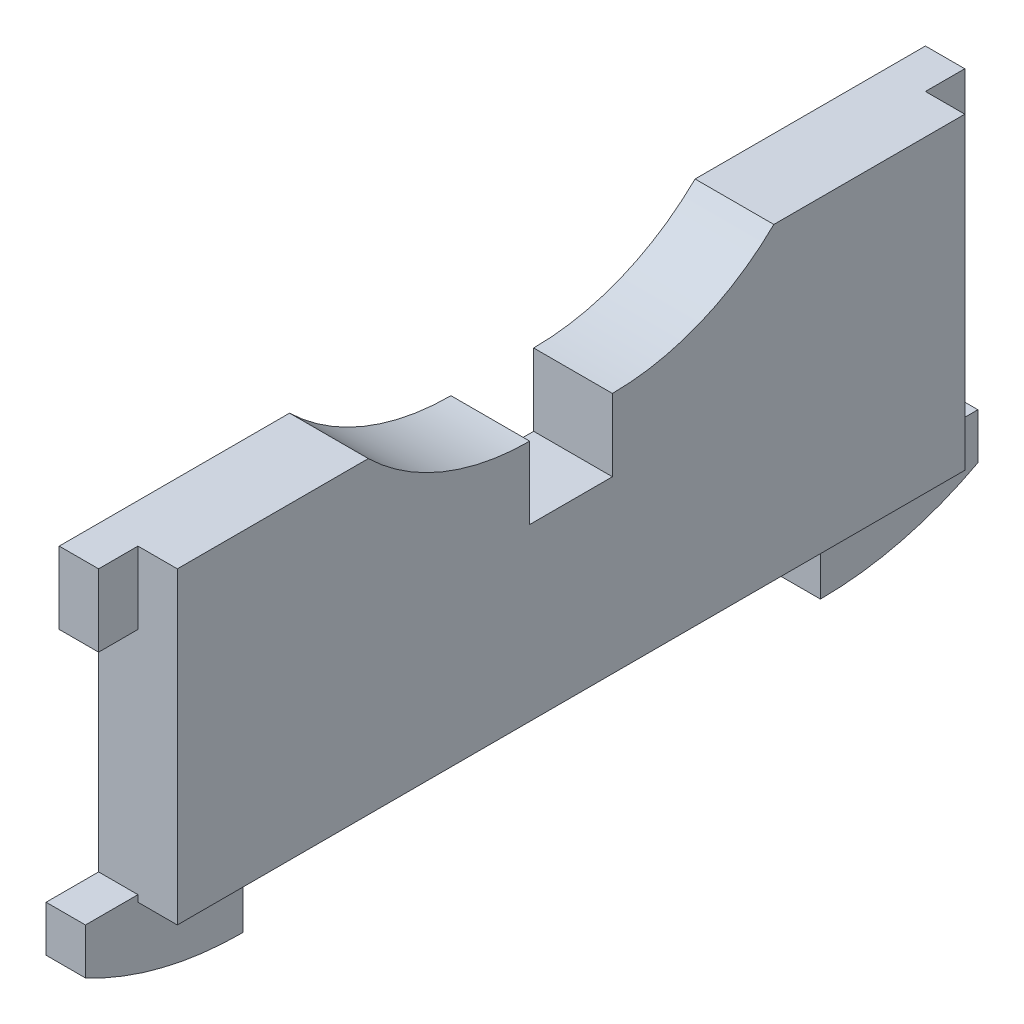
from build123d import *

# Parameters (mm, degrees)
BOSS_EXTRUDE1_DEPTH = 3
BOSS_EXTRUDE2_START = 3
BOSS_EXTRUDE2_DEPTH = 3


with BuildPart() as part:
    # Sketch1 → Boss-Extrude1 (new body)
    with BuildSketch(Plane(origin=(0, 0, 0), x_dir=(0, 0, -1), z_dir=(1, 0, 0))):
        with BuildLine():
            Line((-3.15, 0), (3.15, 0))
            Line((3.15, 0), (3.15, 5.5))
            ThreePointArc((3.15, 5.5), (9.788712225, 6.797767928), (15.45, 10.5))
            Line((15.45, 10.5), (30, 10.5))
            Line((30, 10.5), (30, -13))
            Line((30, -13), (-30, -13))
            Line((-30, -13), (-30, 10.5))
            Line((-30, 10.5), (-15.45, 10.5))
            ThreePointArc((-15.45, 10.5), (-9.788712225, 6.797767928), (-3.15, 5.5))
            Line((-3.15, 5.5), (-3.15, 0))
        make_face()
    extrude(amount=BOSS_EXTRUDE1_DEPTH)

    # Sketch2 → Boss-Extrude2 (add)
    with BuildSketch(Plane.ZY.offset(BOSS_EXTRUDE2_START)):
        with BuildLine():
            Line((34, -12.5), (30, -12.5))
            Line((30, -12.5), (30, 5))
            Line((30, 5), (33, 5))
            Line((33, 5), (33, 10.5))
            Line((33, 10.5), (15.45, 10.5))
            ThreePointArc((15.45, 10.5), (9.788712225, 6.797767928), (3.15, 5.5))
            Line((3.15, 5.5), (3.15, 0))
            Line((3.15, 0), (-3.15, 0))
            Line((-3.15, 0), (-3.15, 5.5))
            ThreePointArc((-3.15, 5.5), (-9.788712225, 6.797767928), (-15.45, 10.5))
            Line((-15.45, 10.5), (-33, 10.5))
            Line((-33, 10.5), (-33, 5))
            Line((-33, 5), (-30, 5))
            Line((-30, 5), (-30, -12.5))
            Line((-30, -12.5), (-34, -12.5))
            Line((-34, -12.5), (-34, -16))
            ThreePointArc((-34, -16), (-28.184658438, -18.238633754), (-22, -19))
            Line((-22, -19), (-22, -13))
            Line((-22, -13), (22, -13))
            Line((22, -13), (22, -19))
            ThreePointArc((22, -19), (28.184658438, -18.238633754), (34, -16))
            Line((34, -16), (34, -12.5))
        make_face()
    extrude(amount=-BOSS_EXTRUDE2_DEPTH)


solid = part.part
